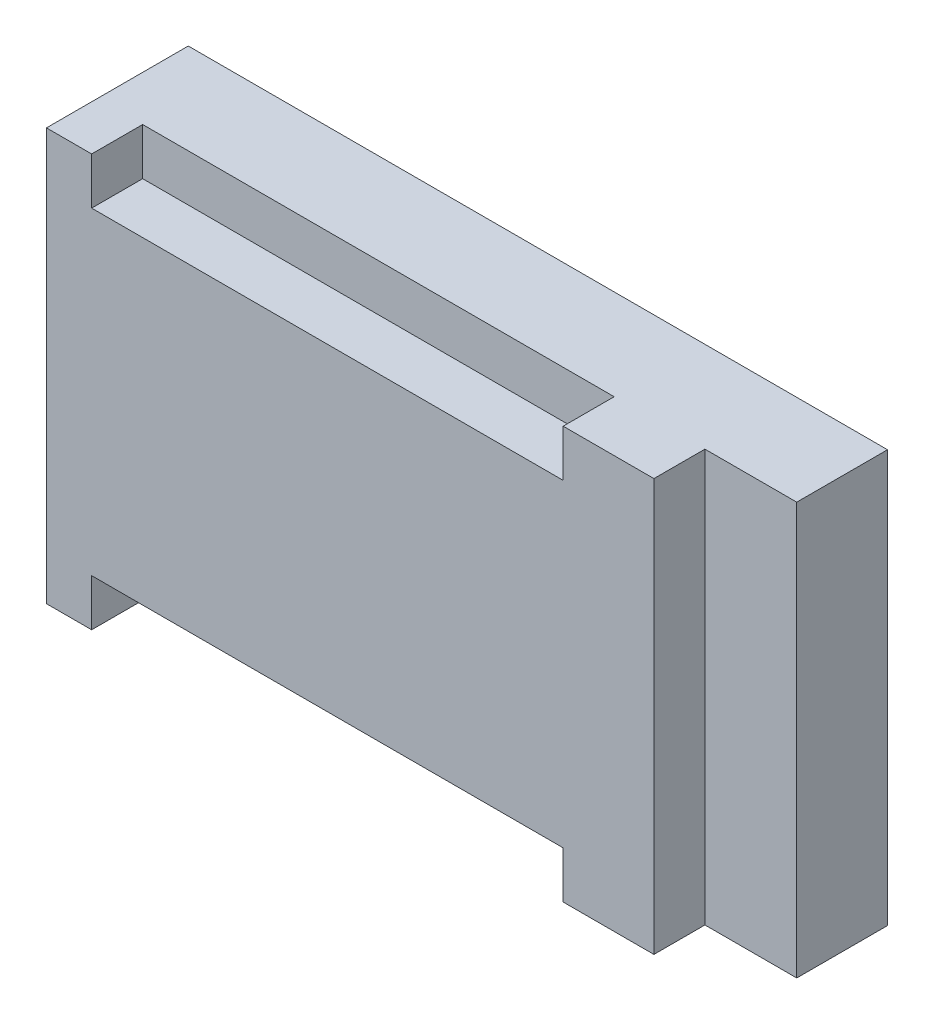
from build123d import *

# Parameters (mm, degrees)
SZKIC1_W                    = 137.1
SZKIC1_H                    = 80.8
DODANIE_WYCI_GNI_CIE1_DEPTH = 27.8
SZKIC2_W                    = 92.445066106
SZKIC2_H                    = 9.2
SZKIC2_W_2                  = 18.000987162
SZKIC2_H_2                  = 80.8
WYTNIJ_WYCI_GNI_CIE1_DEPTH  = 10
SZKIC3_R                    = 1.25
WYTNIJ_WYCI_GNI_CIE2_DEPTH  = 5


with BuildPart() as part:
    # Szkic1 → Dodanie-wyciągnięcie1 (new body)
    with BuildSketch(Plane.XY):
        with Locations((-7.480300087, -6.972885306)):
            Rectangle(SZKIC1_W, SZKIC1_H)
    extrude(amount=DODANIE_WYCI_GNI_CIE1_DEPTH)

    # Szkic2 → Wytnij-wyciągnięcie1 (cut)
    with BuildSketch(Plane.XY.offset(27.8)):
        with Locations((-20.948912207, -42.772885306)):
            Rectangle(SZKIC2_W, SZKIC2_H)
        with Locations((-20.948912207, 28.827114694)):
            Rectangle(SZKIC2_W, SZKIC2_H)
        with Locations((52.069206332, -6.972885306)):
            Rectangle(SZKIC2_W_2, SZKIC2_H_2)
    extrude(amount=-WYTNIJ_WYCI_GNI_CIE1_DEPTH, mode=Mode.SUBTRACT)

    # Szkic3 → Wytnij-wyciągnięcie2 (cut)
    with BuildSketch(Plane(origin=(0, 0, 0), x_dir=(-1, 0, 0), z_dir=(0, 0, -1))):
        with Locations((65.580300087, 12.777114694)):
            Circle(SZKIC3_R)
        with Locations((65.580300087, -26.722885306)):
            Circle(SZKIC3_R)
        with Locations((-35.819699913, -26.722885306)):
            Circle(SZKIC3_R)
        with Locations((-35.819699913, 14.027114694)):
            Circle(SZKIC3_R)
    extrude(amount=-WYTNIJ_WYCI_GNI_CIE2_DEPTH, mode=Mode.SUBTRACT)


solid = part.part
